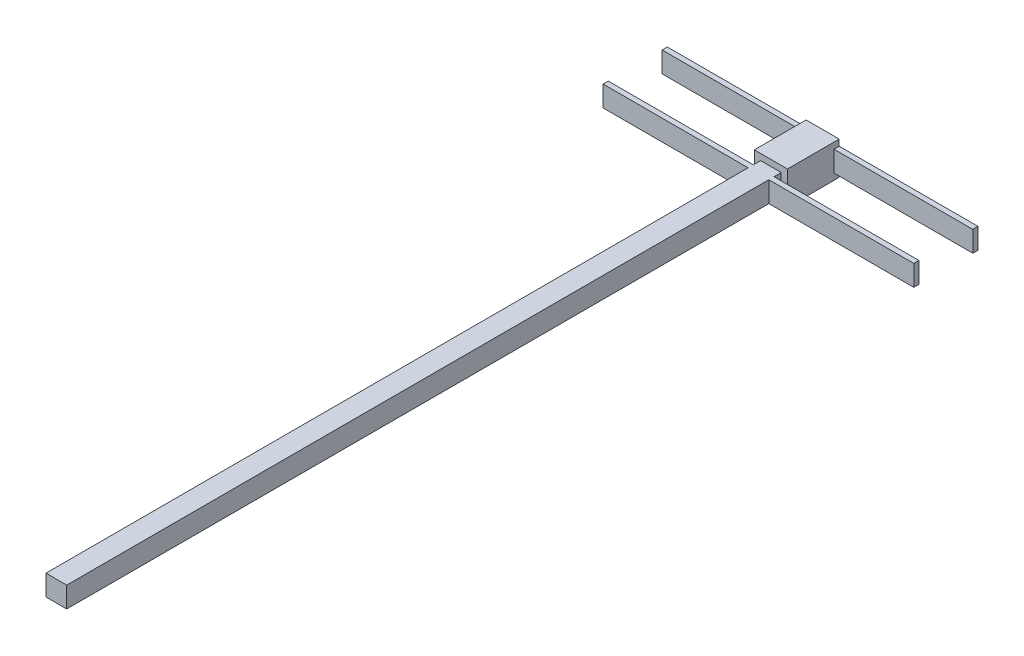
from build123d import *

# Parameters (mm, degrees)
SKETCH_1_W             = 20
SKETCH_1_H             = 20
EXTRUDE_1_DEPTH        = 690
SKETCH_2_W             = 32
SKETCH_2_H             = 32
EXTRUDE_2_DEPTH        = 50
SKETCH_3_W             = 30
SKETCH_3_H             = 30
CUT_EXTRUDE_1_DEPTH    = 46
SKETCH_4_W             = 300
SKETCH_4_H             = 5
EXTRUDE_3_DEPTH        = 20
PATTERN_LINEAR_1_COUNT = 2
PATTERN_LINEAR_1_PITCH = 57


with BuildPart() as part:
    # 草图1 → 凸台-拉伸1 (new body)
    with BuildSketch(Plane.XY):
        Rectangle(SKETCH_1_W, SKETCH_1_H)
    extrude(amount=EXTRUDE_1_DEPTH)

    # 草图2 → 凸台-拉伸2 (add)
    with BuildSketch(Plane(origin=(0, 0, 0), x_dir=(-1, 0, 0), z_dir=(0, 0, -1))):
        Rectangle(SKETCH_2_W, SKETCH_2_H)
    extrude(amount=EXTRUDE_2_DEPTH)

    # 草图3 → 切除-拉伸1 (cut)
    with BuildSketch(Plane(origin=(0, 0, -50), x_dir=(-1, 0, 0), z_dir=(0, 0, -1))):
        Rectangle(SKETCH_3_W, SKETCH_3_H)
    extrude(amount=-CUT_EXTRUDE_1_DEPTH, mode=Mode.SUBTRACT)

    # 草图4 → 凸台-拉伸3 (add)
    with BuildSketch(Plane(origin=(0, 10, 0), x_dir=(1, 0, 0), z_dir=(0, 1, 0))):
        with Locations((0, 47.5)):
            Rectangle(SKETCH_4_W, SKETCH_4_H)
    extrude_3 = extrude(amount=-EXTRUDE_3_DEPTH)

    # 阵列(线性)1: 凸台-拉伸3 ×2
    with Locations(*[(0, 0, i * PATTERN_LINEAR_1_PITCH) for i in range(1, PATTERN_LINEAR_1_COUNT)]):
        add(extrude_3)


solid = part.part
